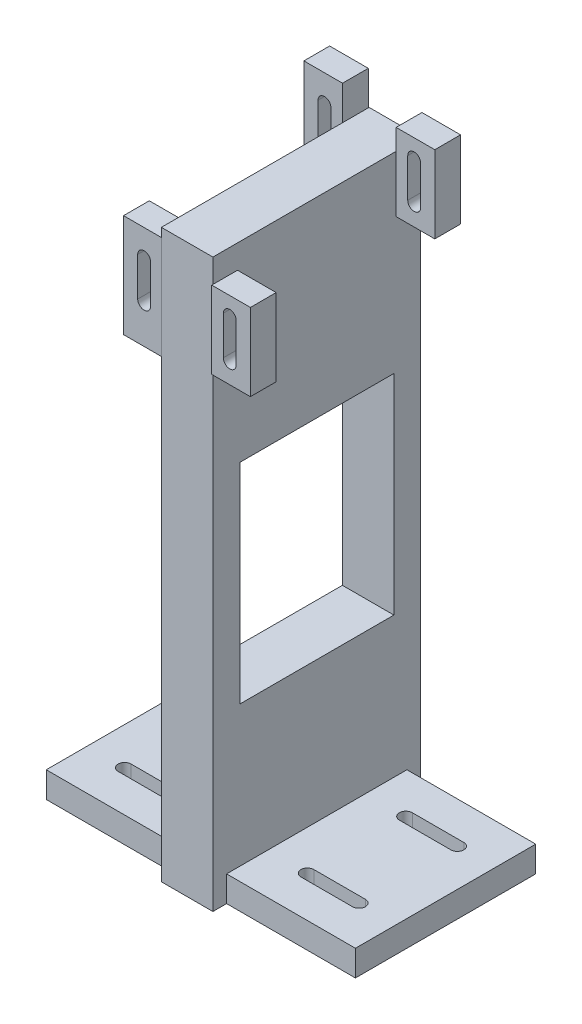
from build123d import *

# Parameters (mm, degrees)
SKETCH1_W           = 120
SKETCH1_H           = 70
BOSS_EXTRUDE1_DEPTH = 10
SKETCH1_3_W         = 20
SKETCH1_3_H         = 70
SKETCH1_3_H_2       = 5.314701235
BOSS_EXTRUDE2_DEPTH = 220
BOSS_EXTRUDE3_START = -20
SKETCH2_W           = 10
SKETCH2_H           = 40
SKETCH2_H_2         = 74.770020504
BOSS_EXTRUDE3_DEPTH = 15
SKETCH3_W           = 59.726354491
SKETCH3_H           = 81.227842107
CUT_EXTRUDE1_DEPTH  = 60
CUT_EXTRUDE2_REACH  = 255.922
CUT_EXTRUDE3_REACH  = 255.922
SKETCH6_W           = 10
SKETCH6_H           = 30
BOSS_EXTRUDE4_DEPTH = 15
CUT_EXTRUDE4_REACH  = 256.324
CUT_EXTRUDE5_REACH  = 256.324


with BuildPart() as part:
    # Sketch1 → Boss-Extrude1 (new body)
    with BuildSketch(Plane(origin=(0, 0, 0), x_dir=(1, 0, 0), z_dir=(0, 1, 0))):
        Rectangle(SKETCH1_W, SKETCH1_H)
        with BuildLine():
            Line((-45.469645663, 21.603573917), (-25.469645663, 21.603573917))
            ThreePointArc((-25.469645663, 21.603573917), (-22.969645663, 19.103573917), (-25.469645663, 16.603573917))
            Line((-25.469645663, 16.603573917), (-45.469645663, 16.603573917))
            ThreePointArc((-45.469645663, 16.603573917), (-47.969645663, 19.103573917), (-45.469645663, 21.603573917))
        make_face(mode=Mode.SUBTRACT)
        with BuildLine():
            Line((45.469645663, 21.603573917), (25.469645663, 21.603573917))
            ThreePointArc((25.469645663, 21.603573917), (22.969645663, 19.103573917), (25.469645663, 16.603573917))
            Line((25.469645663, 16.603573917), (45.469645663, 16.603573917))
            ThreePointArc((45.469645663, 16.603573917), (47.969645663, 19.103573917), (45.469645663, 21.603573917))
        make_face(mode=Mode.SUBTRACT)
        with BuildLine():
            Line((45.469645663, -21.603573917), (25.469645663, -21.603573917))
            ThreePointArc((25.469645663, -21.603573917), (22.969645663, -19.103573917), (25.469645663, -16.603573917))
            Line((25.469645663, -16.603573917), (45.469645663, -16.603573917))
            ThreePointArc((45.469645663, -16.603573917), (47.969645663, -19.103573917), (45.469645663, -21.603573917))
        make_face(mode=Mode.SUBTRACT)
        with BuildLine():
            Line((-45.469645663, -21.603573917), (-25.469645663, -21.603573917))
            ThreePointArc((-25.469645663, -21.603573917), (-22.969645663, -19.103573917), (-25.469645663, -16.603573917))
            Line((-25.469645663, -16.603573917), (-45.469645663, -16.603573917))
            ThreePointArc((-45.469645663, -16.603573917), (-47.969645663, -19.103573917), (-45.469645663, -21.603573917))
        make_face(mode=Mode.SUBTRACT)
    extrude(amount=BOSS_EXTRUDE1_DEPTH)

    # Sketch1<3> → Boss-Extrude2 (add)
    with BuildSketch(Plane(origin=(0, 0, 0), x_dir=(1, 0, 0), z_dir=(0, 1, 0))):
        Rectangle(SKETCH1_3_W, SKETCH1_3_H)
        with Locations((0, 37.657350618)):
            Rectangle(SKETCH1_3_W, SKETCH1_3_H_2)
        with Locations((0, -37.657350618)):
            Rectangle(SKETCH1_3_W, SKETCH1_3_H_2)
    extrude(amount=BOSS_EXTRUDE2_DEPTH)

    # Sketch2 → Boss-Extrude3 (add)
    with BuildSketch(Plane(origin=(10, 0, 0), x_dir=(0, 0, -1), z_dir=(1, 0, 0)).offset(BOSS_EXTRUDE3_START)):
        with Locations((-35, 196.268517414)):
            Rectangle(SKETCH2_W, SKETCH2_H)
        with Locations((35, 195.908265462)):
            Rectangle(SKETCH2_W, SKETCH2_H_2)
    extrude(amount=-BOSS_EXTRUDE3_DEPTH)

    # Sketch3 → Cut-Extrude1 (cut)
    with BuildSketch(Plane(origin=(10, 0, 0), x_dir=(0, 0, -1), z_dir=(1, 0, 0))):
        with Locations((0.081735862, 105.141319111)):
            Rectangle(SKETCH3_W, SKETCH3_H)
    extrude(amount=-CUT_EXTRUDE1_DEPTH, mode=Mode.SUBTRACT)

    # Sketch4 → Cut-Extrude2 (cut, up to next)
    with BuildSketch(Plane.XY.offset(40), mode=Mode.PRIVATE) as cut_extrude2_sk1:
        with BuildLine():
            Line((-14.5, 205.983659563), (-14.5, 190.983659563))
            ThreePointArc((-14.5, 190.983659563), (-17, 188.483659563), (-19.5, 190.983659563))
            Line((-19.5, 190.983659563), (-19.5, 205.983659563))
            ThreePointArc((-19.5, 205.983659563), (-17, 208.483659563), (-14.5, 205.983659563))
        make_face()
    cut_extrude2_tool1 = extrude(cut_extrude2_sk1.sketch, amount=-CUT_EXTRUDE2_REACH, mode=Mode.PRIVATE) & part.part
    add(cut_extrude2_tool1.solids().sort_by_distance((-17, 198.48366, 40))[0], mode=Mode.SUBTRACT)

    # Sketch5 → Cut-Extrude3 (cut, up to next)
    with BuildSketch(Plane(origin=(0, 0, -40), x_dir=(-1, 0, 0), z_dir=(0, 0, -1)), mode=Mode.PRIVATE) as cut_extrude3_sk1:
        with BuildLine():
            Line((19.5, 222.819701207), (19.5, 207.819701207))
            ThreePointArc((19.5, 207.819701207), (17, 205.319701207), (14.5, 207.819701207))
            Line((14.5, 207.819701207), (14.5, 222.819701207))
            ThreePointArc((14.5, 222.819701207), (17, 225.319701207), (19.5, 222.819701207))
        make_face()
    cut_extrude3_tool1 = extrude(cut_extrude3_sk1.sketch, amount=-CUT_EXTRUDE3_REACH, mode=Mode.PRIVATE) & part.part
    # Sketch5 → Cut-Extrude3 (cut, up to next)
    with BuildSketch(Plane(origin=(0, 0, -40), x_dir=(-1, 0, 0), z_dir=(0, 0, -1)), mode=Mode.PRIVATE) as cut_extrude3_sk2:
        with BuildLine():
            Line((19.5, 183.206485392), (19.5, 168.206485392))
            ThreePointArc((19.5, 168.206485392), (17, 165.706485392), (14.5, 168.206485392))
            Line((14.5, 168.206485392), (14.5, 183.206485392))
            ThreePointArc((14.5, 183.206485392), (17, 185.706485392), (19.5, 183.206485392))
        make_face()
    cut_extrude3_tool2 = extrude(cut_extrude3_sk2.sketch, amount=-CUT_EXTRUDE3_REACH, mode=Mode.PRIVATE) & part.part
    add(cut_extrude3_tool1.solids().sort_by_distance((-17, 215.319701, -40))[0], mode=Mode.SUBTRACT)
    add(cut_extrude3_tool2.solids().sort_by_distance((-17, 175.706485, -40))[0], mode=Mode.SUBTRACT)

    # Sketch6 → Boss-Extrude4 (add)
    with BuildSketch(Plane(origin=(10, 0, 0), x_dir=(0, 0, -1), z_dir=(1, 0, 0))):
        with Locations((-35.763941906, 195.796360994)):
            Rectangle(SKETCH6_W, SKETCH6_H)
        with Locations((35.812510383, 213.029875947)):
            Rectangle(SKETCH6_W, SKETCH6_H)
    extrude(amount=BOSS_EXTRUDE4_DEPTH)

    # Sketch7 → Cut-Extrude4 (cut, up to next)
    with BuildSketch(Plane.XY.offset(40.763941906), mode=Mode.PRIVATE) as cut_extrude4_sk1:
        with BuildLine():
            Line((19.5, 203.624140304), (19.5, 188.624140304))
            ThreePointArc((19.5, 188.624140304), (17, 186.124140304), (14.5, 188.624140304))
            Line((14.5, 188.624140304), (14.5, 203.624140304))
            ThreePointArc((14.5, 203.624140304), (17, 206.124140304), (19.5, 203.624140304))
        make_face()
    cut_extrude4_tool1 = extrude(cut_extrude4_sk1.sketch, amount=-CUT_EXTRUDE4_REACH, mode=Mode.PRIVATE) & part.part
    add(cut_extrude4_tool1.solids().sort_by_distance((17, 196.12414, 40.763942))[0], mode=Mode.SUBTRACT)

    # Sketch8 → Cut-Extrude5 (cut, up to next)
    with BuildSketch(Plane(origin=(0, 0, -40.812510383), x_dir=(-1, 0, 0), z_dir=(0, 0, -1)), mode=Mode.PRIVATE) as cut_extrude5_sk1:
        with BuildLine():
            Line((-14.5, 220.7806332), (-14.5, 205.7806332))
            ThreePointArc((-14.5, 205.7806332), (-17, 203.2806332), (-19.5, 205.7806332))
            Line((-19.5, 205.7806332), (-19.5, 220.7806332))
            ThreePointArc((-19.5, 220.7806332), (-17, 223.2806332), (-14.5, 220.7806332))
        make_face()
    cut_extrude5_tool1 = extrude(cut_extrude5_sk1.sketch, amount=-CUT_EXTRUDE5_REACH, mode=Mode.PRIVATE) & part.part
    add(cut_extrude5_tool1.solids().sort_by_distance((17, 213.280633, -40.81251))[0], mode=Mode.SUBTRACT)


solid = part.part
